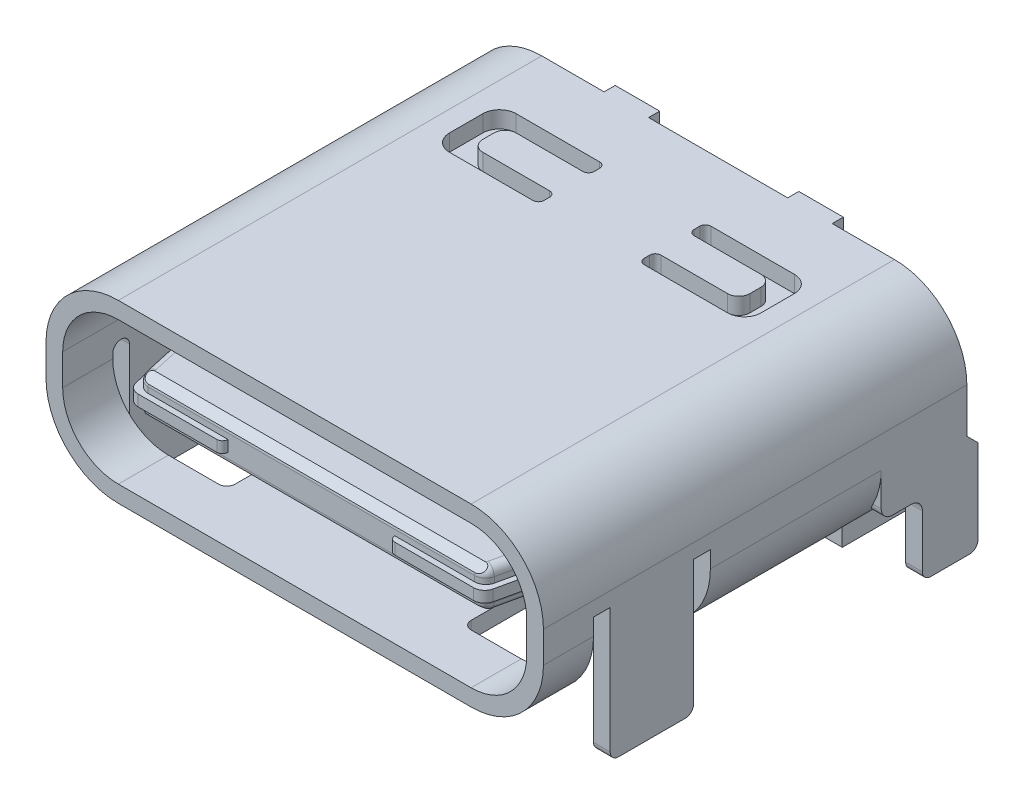
from build123d import *

# Parameters (mm, degrees)
BOSS_EXTRUDE1_DEPTH    = 7.61
SKETCH2_OUTSIDE_W      = 13.372
SKETCH2_OUTSIDE_H      = 7.592
CUT_EXTRUDE1_DEPTH     = 4.7
CUT_EXTRUDE2_DEPTH     = 0.3
BOSS_EXTRUDE2_DEPTH    = 0.2
BOSS_EXTRUDE3_DEPTH    = 0.3
CUT_EXTRUDE3_DEPTH     = 1.6
SKETCH7_W              = 8.34
SKETCH7_H              = 1.94
CUT_EXTRUDE4_DEPTH     = 0.15
BOSS_EXTRUDE4_DEPTH    = 1.94
BOSS_EXTRUDE5_DEPTH    = 0.2
BOSS_EXTRUDE5_2_DEPTH  = 0.2
BOSS_EXTRUDE5_3_DEPTH  = 0.2
BOSS_EXTRUDE5_4_DEPTH  = 0.2
BOSS_EXTRUDE5_5_DEPTH  = 0.2
BOSS_EXTRUDE5_6_DEPTH  = 0.2
BOSS_EXTRUDE5_7_DEPTH  = 0.2
BOSS_EXTRUDE5_8_DEPTH  = 0.2
BOSS_EXTRUDE5_9_DEPTH  = 0.2
BOSS_EXTRUDE5_10_DEPTH = 0.2
BOSS_EXTRUDE5_11_DEPTH = 0.2
BOSS_EXTRUDE5_12_DEPTH = 0.2
BOSS_EXTRUDE5_13_DEPTH = 0.2
BOSS_EXTRUDE5_14_DEPTH = 0.2
BOSS_EXTRUDE5_15_DEPTH = 0.2
BOSS_EXTRUDE5_16_DEPTH = 0.2
BOSS_EXTRUDE5_17_DEPTH = 0.2
BOSS_EXTRUDE5_18_DEPTH = 0.2
BOSS_EXTRUDE5_19_DEPTH = 0.2
BOSS_EXTRUDE5_20_DEPTH = 0.2
BOSS_EXTRUDE5_21_DEPTH = 0.2
BOSS_EXTRUDE5_22_DEPTH = 0.2
BOSS_EXTRUDE5_23_DEPTH = 0.2
BOSS_EXTRUDE5_24_DEPTH = 0.2
BOSS_EXTRUDE5_25_DEPTH = 0.2
BOSS_EXTRUDE5_26_DEPTH = 0.2
CUT_EXTRUDE5_START     = -6.55
CUT_EXTRUDE5_DEPTH     = 6.9
CUT_EXTRUDE6_START     = -6.2
CUT_EXTRUDE6_DEPTH     = 6.2
BOSS_EXTRUDE6_DEPTH    = 1.62
BOSS_EXTRUDE7_DEPTH    = 0.35
BOSS_EXTRUDE8_DEPTH    = 0.1
BOSS_EXTRUDE8_2_DEPTH  = 0.1
FILLET2_R              = 0.15
CUT_EXTRUDE10_DEPTH    = 12.979152799


with BuildPart() as part:
    # Sketch1 → Boss-Extrude1 (new body)
    with BuildSketch(Plane.XY):
        with BuildLine():
            Line((-4.47, 0.28), (-4.47, -0.28))
            ThreePointArc((-4.47, -0.28), (-4.089238816, -1.199238816), (-3.17, -1.58))
            Line((-3.17, -1.58), (3.17, -1.58))
            ThreePointArc((3.17, -1.58), (4.089238816, -1.199238816), (4.47, -0.28))
            Line((4.47, -0.28), (4.47, 0.28))
            ThreePointArc((4.47, 0.28), (4.089238816, 1.199238816), (3.17, 1.58))
            Line((3.17, 1.58), (-3.17, 1.58))
            ThreePointArc((-3.17, 1.58), (-4.089238816, 1.199238816), (-4.47, 0.28))
        make_face()
    extrude(amount=BOSS_EXTRUDE1_DEPTH)

    # Sketch2 outside → Cut-Extrude1 (cut)
    # profile 1 of 2: a face of its own
    with BuildSketch(Plane.XY.offset(7.61)):
        Rectangle(SKETCH2_OUTSIDE_W, SKETCH2_OUTSIDE_H)
        with BuildLine():
            Line((-4.47, 0.28), (-4.47, -0.28))
            ThreePointArc((-4.47, -0.28), (-4.089238816, -1.199238816), (-3.17, -1.58))
            Line((-3.17, -1.58), (3.17, -1.58))
            ThreePointArc((3.17, -1.58), (4.089238816, -1.199238816), (4.47, -0.28))
            Line((4.47, -0.28), (4.47, 0.28))
            ThreePointArc((4.47, 0.28), (4.089238816, 1.199238816), (3.17, 1.58))
            Line((3.17, 1.58), (-3.17, 1.58))
            ThreePointArc((-3.17, 1.58), (-4.089238816, 1.199238816), (-4.47, 0.28))
        make_face(mode=Mode.SUBTRACT)
    # profile 2 of 2: a face of its own
    with BuildSketch(Plane.XY.offset(7.61)):
        with BuildLine():
            Line((3.17, 1.28), (-3.17, 1.28))
            ThreePointArc((-3.17, 1.28), (-3.877106781, 0.987106781), (-4.17, 0.28))
            Line((-4.17, 0.28), (-4.17, -0.28))
            ThreePointArc((-4.17, -0.28), (-3.877106781, -0.987106781), (-3.17, -1.28))
            Line((-3.17, -1.28), (3.17, -1.28))
            ThreePointArc((3.17, -1.28), (3.877106781, -0.987106781), (4.17, -0.28))
            Line((4.17, -0.28), (4.17, 0.28))
            ThreePointArc((4.17, 0.28), (3.877106781, 0.987106781), (3.17, 1.28))
        make_face()
    extrude(amount=-CUT_EXTRUDE1_DEPTH, mode=Mode.SUBTRACT)

    # Sketch3 → Cut-Extrude2 (cut)
    with BuildSketch(Plane(origin=(0, 1.58, 0), x_dir=(1, 0, 0), z_dir=(0, 1, 0))):
        with BuildLine():
            Line((-0.9, -1.33), (-0.9, -1.23))
            ThreePointArc((-0.9, -1.23), (-0.929289322, -1.159289322), (-1, -1.13))
            Line((-1, -1.13), (-2.5, -1.13))
            ThreePointArc((-2.5, -1.13), (-2.712132034, -1.217867966), (-2.8, -1.43))
            Line((-2.8, -1.43), (-2.8, -2.03))
            ThreePointArc((-2.8, -2.03), (-2.712132034, -2.242132034), (-2.5, -2.33))
            Line((-2.5, -2.33), (-1, -2.33))
            ThreePointArc((-1, -2.33), (-0.929289322, -2.300710678), (-0.9, -2.23))
            Line((-0.9, -2.23), (-0.9, -2.13))
            ThreePointArc((-0.9, -2.13), (-0.929289322, -2.059289322), (-1, -2.03))
            Line((-1, -2.03), (-2.2, -2.03))
            ThreePointArc((-2.2, -2.03), (-2.341421356, -1.971421356), (-2.4, -1.83))
            Line((-2.4, -1.83), (-2.4, -1.63))
            ThreePointArc((-2.4, -1.63), (-2.341421356, -1.488578644), (-2.2, -1.43))
            Line((-2.2, -1.43), (-1, -1.43))
            ThreePointArc((-1, -1.43), (-0.929289322, -1.400710678), (-0.9, -1.33))
        make_face()
        with BuildLine():
            Line((2.5, -1.13), (1, -1.13))
            ThreePointArc((1, -1.13), (0.929289322, -1.159289322), (0.9, -1.23))
            Line((0.9, -1.23), (0.9, -1.33))
            ThreePointArc((0.9, -1.33), (0.929289322, -1.400710678), (1, -1.43))
            Line((1, -1.43), (2.2, -1.43))
            ThreePointArc((2.2, -1.43), (2.341421356, -1.488578644), (2.4, -1.63))
            Line((2.4, -1.63), (2.4, -1.83))
            ThreePointArc((2.4, -1.83), (2.341421356, -1.971421356), (2.2, -2.03))
            Line((2.2, -2.03), (1, -2.03))
            ThreePointArc((1, -2.03), (0.929289322, -2.059289322), (0.9, -2.13))
            Line((0.9, -2.13), (0.9, -2.23))
            ThreePointArc((0.9, -2.23), (0.929289322, -2.300710678), (1, -2.33))
            Line((1, -2.33), (2.5, -2.33))
            ThreePointArc((2.5, -2.33), (2.712132034, -2.242132034), (2.8, -2.03))
            Line((2.8, -2.03), (2.8, -1.43))
            ThreePointArc((2.8, -1.43), (2.712132034, -1.217867966), (2.5, -1.13))
        make_face()
    extrude(amount=-CUT_EXTRUDE2_DEPTH, mode=Mode.SUBTRACT)

    # Sketch4 → Boss-Extrude2 (add)
    with BuildSketch(Plane(origin=(0, 0, 0), x_dir=(-1, 0, 0), z_dir=(0, 0, -1))):
        with BuildLine():
            Line((-3.97, 0.48), (-3.97, -0.42))
            ThreePointArc((-3.97, -0.42), (-3.882132034, -0.632132034), (-3.67, -0.72))
            Line((-3.67, -0.72), (3.67, -0.72))
            ThreePointArc((3.67, -0.72), (3.882132034, -0.632132034), (3.97, -0.42))
            Line((3.97, -0.42), (3.97, 0.48))
            ThreePointArc((3.97, 0.48), (3.823553391, 0.833553391), (3.47, 0.98))
            Line((3.47, 0.98), (2.05, 0.98))
            Line((2.05, 0.98), (2.05, 1.58))
            Line((2.05, 1.58), (1.25, 1.58))
            Line((1.25, 1.58), (1.25, 0.98))
            Line((1.25, 0.98), (-1.25, 0.98))
            Line((-1.25, 0.98), (-1.25, 1.58))
            Line((-1.25, 1.58), (-2.05, 1.58))
            Line((-2.05, 1.58), (-2.05, 0.98))
            Line((-2.05, 0.98), (-3.47, 0.98))
            ThreePointArc((-3.47, 0.98), (-3.823553391, 0.833553391), (-3.97, 0.48))
        make_face()
    extrude(amount=BOSS_EXTRUDE2_DEPTH)

    # Sketch5 → Boss-Extrude3 (add)
    with BuildSketch(Plane(origin=(4.47, 0, 0), x_dir=(0, 0, -1), z_dir=(1, 0, 0))):
        with BuildLine():
            Line((-4.91, -0.28), (-6.41, -0.28))
            Line((-6.41, -0.28), (-6.41, -2.23))
            ThreePointArc((-6.41, -2.23), (-6.366066017, -2.336066017), (-6.26, -2.38))
            Line((-6.26, -2.38), (-5.06, -2.38))
            ThreePointArc((-5.06, -2.38), (-4.953933983, -2.336066017), (-4.91, -2.23))
            Line((-4.91, -2.23), (-4.91, -0.28))
        make_face()
        with BuildLine():
            ThreePointArc((-6.71, -0.2), (-6.56, -0.05), (-6.41, -0.2))
            Line((-6.41, -0.2), (-6.41, -0.28))
            Line((-6.41, -0.28), (-4.91, -0.28))
            Line((-4.91, -0.28), (-4.91, -0.2))
            ThreePointArc((-4.91, -0.2), (-4.76, -0.05), (-4.61, -0.2))
            Line((-4.61, -0.2), (-4.61, -0.28))
            Line((-4.61, -0.28), (-1.54, -0.28))
            Line((-1.54, -0.28), (0, -0.28))
            Line((0, -0.28), (0, 0.209679923))
            Line((0, 0.209679923), (-7.61, 0.209679923))
            Line((-7.61, 0.209679923), (-7.61, -0.28))
            Line((-7.61, -0.28), (-6.71, -0.28))
            Line((-6.71, -0.28), (-6.71, -0.2))
        make_face()
        with BuildLine():
            Line((0, -0.28), (-1.54, -0.28))
            Line((-1.54, -0.28), (-1.54, -0.88))
            ThreePointArc((-1.54, -0.88), (-1.481421356, -1.021421356), (-1.34, -1.08))
            Line((-1.34, -1.08), (-1, -1.08))
            ThreePointArc((-1, -1.08), (-0.858578644, -1.138578644), (-0.8, -1.28))
            Line((-0.8, -1.28), (-0.8, -2.23))
            ThreePointArc((-0.8, -2.23), (-0.756066017, -2.336066017), (-0.65, -2.38))
            Line((-0.65, -2.38), (0.05, -2.38))
            ThreePointArc((0.05, -2.38), (0.156066017, -2.336066017), (0.2, -2.23))
            Line((0.2, -2.23), (0.2, -0.72))
            Line((0.2, -0.72), (0, -0.52))
            Line((0, -0.52), (0, -0.28))
        make_face()
    boss_extrude3 = extrude(amount=-BOSS_EXTRUDE3_DEPTH)

    # Sketch6 → Cut-Extrude3 (cut)
    with BuildSketch(Plane.XZ.offset(1.58)):
        with BuildLine():
            Line((4.47, 4.61), (3.17, 4.61))
            Line((3.17, 4.61), (2.27, 4.61))
            ThreePointArc((2.27, 4.61), (2.163933983, 4.653933983), (2.12, 4.76))
            Line((2.12, 4.76), (2.12, 6.56))
            ThreePointArc((2.12, 6.56), (2.163933983, 6.666066017), (2.27, 6.71))
            Line((2.27, 6.71), (3.17, 6.71))
            Line((3.17, 6.71), (4.47, 6.71))
            Line((4.47, 6.71), (4.47, 6.41))
            Line((4.47, 6.41), (4.17, 6.41))
            Line((4.17, 6.41), (4.17, 4.91))
            Line((4.17, 4.91), (4.47, 4.91))
            Line((4.47, 4.91), (4.47, 4.61))
        make_face()
        with BuildLine():
            Line((-3.17, 4.61), (-4.47, 4.61))
            Line((-4.47, 4.61), (-4.47, 6.71))
            Line((-4.47, 6.71), (-3.17, 6.71))
            Line((-3.17, 6.71), (-2.27, 6.71))
            ThreePointArc((-2.27, 6.71), (-2.163933983, 6.666066017), (-2.12, 6.56))
            Line((-2.12, 6.56), (-2.12, 4.76))
            ThreePointArc((-2.12, 4.76), (-2.163933983, 4.653933983), (-2.27, 4.61))
            Line((-2.27, 4.61), (-3.17, 4.61))
        make_face()
    extrude(amount=-CUT_EXTRUDE3_DEPTH, mode=Mode.SUBTRACT)

    # Sketch7 → Cut-Extrude4 (cut)
    with BuildSketch(Plane.XZ.offset(1.58)):
        with Locations((0, 0.97)):
            Rectangle(SKETCH7_W, SKETCH7_H)
    extrude(amount=-CUT_EXTRUDE4_DEPTH, mode=Mode.SUBTRACT)

    # Sketch8 → Boss-Extrude4 (add)
    with BuildSketch(Plane(origin=(0, 0, 0), x_dir=(-1, 0, 0), z_dir=(0, 0, -1))):
        with BuildLine():
            Line((-3.776217783, -1.43), (-4.17, -1.43))
            Line((-4.17, -1.43), (-4.17, -1.110662386))
            ThreePointArc((-4.17, -1.110662386), (-3.988827222, -1.289713811), (-3.776217783, -1.43))
        make_face()
        with BuildLine():
            Line((4.17, -1.43), (4.17, -1.110662386))
            ThreePointArc((4.17, -1.110662386), (3.988827222, -1.289713811), (3.776217783, -1.43))
            Line((3.776217783, -1.43), (4.17, -1.43))
        make_face()
    extrude(amount=-BOSS_EXTRUDE4_DEPTH)

    # Mirror1: Boss-Extrude3 across plane
    add(boss_extrude3.mirror(Plane.ZY))


with BuildPart() as body_2:
    # Sketch9 → Boss-Extrude5 (new body)
    with BuildSketch(Plane.XZ.offset(1.43)):
        Polygon((-0.6, 0.05), (-0.6, -0.29), (-0.4, -0.29), (-0.4, 0.05), (-0.4, 0.2), (-0.6, 0.2), align=None)
    extrude(amount=BOSS_EXTRUDE5_DEPTH)


with BuildPart() as body_3:
    # Sketch9 → Boss-Extrude5 2 (new body)
    with BuildSketch(Plane.XZ.offset(1.43)):
        Polygon((-0.9, 0.05), (-0.9, 0.2), (-1.1, 0.2), (-1.1, 0.05), (-1.1, -0.29), (-0.9, -0.29), align=None)
    extrude(amount=BOSS_EXTRUDE5_2_DEPTH)


with BuildPart() as body_4:
    # Sketch9 → Boss-Extrude5 3 (new body)
    with BuildSketch(Plane.XZ.offset(1.43)):
        Polygon((-1.6, 0.05), (-1.6, -0.29), (-1.4, -0.29), (-1.4, 0.05), (-1.4, 0.2), (-1.6, 0.2), align=None)
    extrude(amount=BOSS_EXTRUDE5_3_DEPTH)


with BuildPart() as body_5:
    # Sketch9 → Boss-Extrude5 4 (new body)
    with BuildSketch(Plane.XZ.offset(1.43)):
        Polygon((-1.9, 0.05), (-1.9, 0.2), (-2.1, 0.2), (-2.1, 0.05), (-2.1, -0.29), (-1.9, -0.29), align=None)
    extrude(amount=BOSS_EXTRUDE5_4_DEPTH)


with BuildPart() as body_6:
    # Sketch9 → Boss-Extrude5 5 (new body)
    with BuildSketch(Plane.XZ.offset(1.43)):
        Polygon((-2.6, 0.05), (-2.6, -0.29), (-2.4, -0.29), (-2.4, 0.05), (-2.4, 0.2), (-2.6, 0.2), align=None)
    extrude(amount=BOSS_EXTRUDE5_5_DEPTH)


with BuildPart() as body_7:
    # Sketch9 → Boss-Extrude5 6 (new body)
    with BuildSketch(Plane.XZ.offset(1.43)):
        Polygon((-2.9, 0.05), (-2.9, 0.2), (-3.1, 0.2), (-3.1, 0.05), (-3.1, -0.29), (-2.9, -0.29), align=None)
    extrude(amount=BOSS_EXTRUDE5_6_DEPTH)


with BuildPart() as body_8:
    # Sketch9 → Boss-Extrude5 7 (new body)
    with BuildSketch(Plane.XZ.offset(1.43)):
        Polygon((0.6, 0.05), (0.6, 0.2), (0.4, 0.2), (0.4, 0.05), (0.4, -0.29), (0.6, -0.29), align=None)
    extrude(amount=BOSS_EXTRUDE5_7_DEPTH)


with BuildPart() as body_9:
    # Sketch9 → Boss-Extrude5 8 (new body)
    with BuildSketch(Plane.XZ.offset(1.43)):
        Polygon((0.9, 0.05), (0.9, -0.29), (1.1, -0.29), (1.1, 0.05), (1.1, 0.2), (0.9, 0.2), align=None)
    extrude(amount=BOSS_EXTRUDE5_8_DEPTH)


with BuildPart() as body_10:
    # Sketch9 → Boss-Extrude5 9 (new body)
    with BuildSketch(Plane.XZ.offset(1.43)):
        Polygon((1.6, 0.05), (1.6, 0.2), (1.4, 0.2), (1.4, 0.05), (1.4, -0.29), (1.6, -0.29), align=None)
    extrude(amount=BOSS_EXTRUDE5_9_DEPTH)


with BuildPart() as body_11:
    # Sketch9 → Boss-Extrude5 10 (new body)
    with BuildSketch(Plane.XZ.offset(1.43)):
        Polygon((1.9, 0.05), (1.9, -0.29), (2.1, -0.29), (2.1, 0.05), (2.1, 0.2), (1.9, 0.2), align=None)
    extrude(amount=BOSS_EXTRUDE5_10_DEPTH)


with BuildPart() as body_12:
    # Sketch9 → Boss-Extrude5 11 (new body)
    with BuildSketch(Plane.XZ.offset(1.43)):
        Polygon((2.6, 0.05), (2.6, 0.2), (2.4, 0.2), (2.4, 0.05), (2.4, -0.29), (2.6, -0.29), align=None)
    extrude(amount=BOSS_EXTRUDE5_11_DEPTH)


with BuildPart() as body_13:
    # Sketch9 → Boss-Extrude5 12 (new body)
    with BuildSketch(Plane.XZ.offset(1.43)):
        Polygon((2.9, 0.05), (2.9, -0.29), (3.1, -0.29), (3.1, 0.05), (3.1, 0.2), (2.9, 0.2), align=None)
    extrude(amount=BOSS_EXTRUDE5_12_DEPTH)


with BuildPart() as body_14:
    # Sketch9 → Boss-Extrude5 13 (new body)
    with BuildSketch(Plane.XZ.offset(1.43)):
        Polygon((2.65, 1.31), (2.65, 1.01), (2.85, 1.01), (2.85, 1.31), (2.85, 1.46), (2.65, 1.46), align=None)
    extrude(amount=BOSS_EXTRUDE5_13_DEPTH)


with BuildPart() as body_15:
    # Sketch9 → Boss-Extrude5 14 (new body)
    with BuildSketch(Plane.XZ.offset(1.43)):
        Polygon((3.45, 1.31), (3.45, 1.46), (3.15, 1.46), (3.15, 1.31), (3.15, 1.01), (3.45, 1.01), align=None)
    extrude(amount=BOSS_EXTRUDE5_14_DEPTH)


with BuildPart() as body_16:
    # Sketch9 → Boss-Extrude5 15 (new body)
    with BuildSketch(Plane.XZ.offset(1.43)):
        Polygon((2.15, 1.31), (2.15, 1.01), (2.35, 1.01), (2.35, 1.31), (2.35, 1.46), (2.15, 1.46), align=None)
    extrude(amount=BOSS_EXTRUDE5_15_DEPTH)


with BuildPart() as body_17:
    # Sketch9 → Boss-Extrude5 16 (new body)
    with BuildSketch(Plane.XZ.offset(1.43)):
        Polygon((1.85, 1.31), (1.85, 1.46), (1.65, 1.46), (1.65, 1.31), (1.65, 1.01), (1.85, 1.01), align=None)
    extrude(amount=BOSS_EXTRUDE5_16_DEPTH)


with BuildPart() as body_18:
    # Sketch9 → Boss-Extrude5 17 (new body)
    with BuildSketch(Plane.XZ.offset(1.43)):
        Polygon((1.15, 1.31), (1.15, 1.01), (1.35, 1.01), (1.35, 1.31), (1.35, 1.46), (1.15, 1.46), align=None)
    extrude(amount=BOSS_EXTRUDE5_17_DEPTH)


with BuildPart() as body_19:
    # Sketch9 → Boss-Extrude5 18 (new body)
    with BuildSketch(Plane.XZ.offset(1.43)):
        Polygon((0.85, 1.31), (0.85, 1.46), (0.65, 1.46), (0.65, 1.31), (0.65, 1.01), (0.85, 1.01), align=None)
    extrude(amount=BOSS_EXTRUDE5_18_DEPTH)


with BuildPart() as body_20:
    # Sketch9 → Boss-Extrude5 19 (new body)
    with BuildSketch(Plane.XZ.offset(1.43)):
        Polygon((0.15, 1.31), (0.15, 1.01), (0.35, 1.01), (0.35, 1.31), (0.35, 1.46), (0.15, 1.46), align=None)
    extrude(amount=BOSS_EXTRUDE5_19_DEPTH)


with BuildPart() as body_21:
    # Sketch9 → Boss-Extrude5 20 (new body)
    with BuildSketch(Plane.XZ.offset(1.43)):
        Polygon((-0.15, 1.31), (-0.15, 1.46), (-0.35, 1.46), (-0.35, 1.31), (-0.35, 1.01), (-0.15, 1.01), align=None)
    extrude(amount=BOSS_EXTRUDE5_20_DEPTH)


with BuildPart() as body_22:
    # Sketch9 → Boss-Extrude5 21 (new body)
    with BuildSketch(Plane.XZ.offset(1.43)):
        Polygon((-0.85, 1.31), (-0.85, 1.01), (-0.65, 1.01), (-0.65, 1.31), (-0.65, 1.46), (-0.85, 1.46), align=None)
    extrude(amount=BOSS_EXTRUDE5_21_DEPTH)


with BuildPart() as body_23:
    # Sketch9 → Boss-Extrude5 22 (new body)
    with BuildSketch(Plane.XZ.offset(1.43)):
        Polygon((-1.15, 1.31), (-1.15, 1.46), (-1.35, 1.46), (-1.35, 1.31), (-1.35, 1.01), (-1.15, 1.01), align=None)
    extrude(amount=BOSS_EXTRUDE5_22_DEPTH)


with BuildPart() as body_24:
    # Sketch9 → Boss-Extrude5 23 (new body)
    with BuildSketch(Plane.XZ.offset(1.43)):
        Polygon((-1.85, 1.31), (-1.85, 1.01), (-1.65, 1.01), (-1.65, 1.31), (-1.65, 1.46), (-1.85, 1.46), align=None)
    extrude(amount=BOSS_EXTRUDE5_23_DEPTH)


with BuildPart() as body_25:
    # Sketch9 → Boss-Extrude5 24 (new body)
    with BuildSketch(Plane.XZ.offset(1.43)):
        Polygon((-2.15, 1.31), (-2.15, 1.46), (-2.35, 1.46), (-2.35, 1.31), (-2.35, 1.01), (-2.15, 1.01), align=None)
    extrude(amount=BOSS_EXTRUDE5_24_DEPTH)


with BuildPart() as body_26:
    # Sketch9 → Boss-Extrude5 25 (new body)
    with BuildSketch(Plane.XZ.offset(1.43)):
        Polygon((-2.85, 1.31), (-2.85, 1.01), (-2.65, 1.01), (-2.65, 1.31), (-2.65, 1.46), (-2.85, 1.46), align=None)
    extrude(amount=BOSS_EXTRUDE5_25_DEPTH)


with BuildPart() as body_27:
    # Sketch9 → Boss-Extrude5 26 (new body)
    with BuildSketch(Plane.XZ.offset(1.43)):
        Polygon((-3.15, 1.31), (-3.15, 1.46), (-3.45, 1.46), (-3.45, 1.31), (-3.45, 1.01), (-3.15, 1.01), align=None)
    extrude(amount=BOSS_EXTRUDE5_26_DEPTH)


with BuildPart() as cut_extrude5_tool:
    # Sketch10 → Cut-Extrude5 (new body)
    with BuildSketch(Plane.ZY.offset(3.1).offset(CUT_EXTRUDE5_START)):
        with BuildLine():
            Line((1.01, -1.63), (1.31711545, -1.63))
            ThreePointArc((1.31711545, -1.63), (1.418150084, -1.588150084), (1.46, -1.48711545))
            Line((1.46, -1.48711545), (1.46, -1.43))
            Line((1.46, -1.43), (1.57898756, -1.531986034))
            Line((1.57898756, -1.531986034), (1.518730657, -1.78951256))
            Line((1.518730657, -1.78951256), (1.01, -1.63))
        make_face()
        with BuildLine():
            Line((-0.29, -1.63), (0.099975763, -1.63))
            ThreePointArc((0.099975763, -1.63), (0.170702109, -1.600719248), (0.2, -1.53))
            Line((0.2, -1.53), (0.2, -1.43))
            Line((0.2, -1.43), (0.448197351, -1.776454988))
            Line((0.448197351, -1.776454988), (0.039944898, -1.806792797))
            Line((0.039944898, -1.806792797), (-0.29, -1.63))
        make_face()
    extrude(amount=CUT_EXTRUDE5_DEPTH)


with BuildPart() as body_14_1:
    add(body_14.part)

    # Cut-Extrude5: cut by cut_extrude5_tool
    add(cut_extrude5_tool.part, mode=Mode.SUBTRACT)


with BuildPart() as body_15_1:
    add(body_15.part)

    # Cut-Extrude5: cut by cut_extrude5_tool
    add(cut_extrude5_tool.part, mode=Mode.SUBTRACT)


with BuildPart() as body_16_1:
    add(body_16.part)

    # Cut-Extrude5: cut by cut_extrude5_tool
    add(cut_extrude5_tool.part, mode=Mode.SUBTRACT)


with BuildPart() as body_17_1:
    add(body_17.part)

    # Cut-Extrude5: cut by cut_extrude5_tool
    add(cut_extrude5_tool.part, mode=Mode.SUBTRACT)


with BuildPart() as body_18_1:
    add(body_18.part)

    # Cut-Extrude5: cut by cut_extrude5_tool
    add(cut_extrude5_tool.part, mode=Mode.SUBTRACT)


with BuildPart() as body_19_1:
    add(body_19.part)

    # Cut-Extrude5: cut by cut_extrude5_tool
    add(cut_extrude5_tool.part, mode=Mode.SUBTRACT)


with BuildPart() as body_20_1:
    add(body_20.part)

    # Cut-Extrude5: cut by cut_extrude5_tool
    add(cut_extrude5_tool.part, mode=Mode.SUBTRACT)


with BuildPart() as body_21_1:
    add(body_21.part)

    # Cut-Extrude5: cut by cut_extrude5_tool
    add(cut_extrude5_tool.part, mode=Mode.SUBTRACT)


with BuildPart() as body_22_1:
    add(body_22.part)

    # Cut-Extrude5: cut by cut_extrude5_tool
    add(cut_extrude5_tool.part, mode=Mode.SUBTRACT)


with BuildPart() as body_23_1:
    add(body_23.part)

    # Cut-Extrude5: cut by cut_extrude5_tool
    add(cut_extrude5_tool.part, mode=Mode.SUBTRACT)


with BuildPart() as body_24_1:
    add(body_24.part)

    # Cut-Extrude5: cut by cut_extrude5_tool
    add(cut_extrude5_tool.part, mode=Mode.SUBTRACT)


with BuildPart() as body_25_1:
    add(body_25.part)

    # Cut-Extrude5: cut by cut_extrude5_tool
    add(cut_extrude5_tool.part, mode=Mode.SUBTRACT)


with BuildPart() as body_26_1:
    add(body_26.part)

    # Cut-Extrude5: cut by cut_extrude5_tool
    add(cut_extrude5_tool.part, mode=Mode.SUBTRACT)


with BuildPart() as body_27_1:
    add(body_27.part)

    # Cut-Extrude5: cut by cut_extrude5_tool
    add(cut_extrude5_tool.part, mode=Mode.SUBTRACT)


with BuildPart() as cut_extrude6_tool:
    # Sketch11 → Cut-Extrude6 (new body)
    with BuildSketch(Plane.ZY.offset(3.1).offset(CUT_EXTRUDE6_START)):
        with BuildLine():
            Line((-0.29, -1.63), (0.099975763, -1.63))
            ThreePointArc((0.099975763, -1.63), (0.170702109, -1.600719248), (0.2, -1.53))
            Line((0.2, -1.53), (0.2, -1.43))
            Line((0.2, -1.43), (0.448197351, -1.776454988))
            Line((0.448197351, -1.776454988), (0.039944898, -1.806792797))
            Line((0.039944898, -1.806792797), (-0.29, -1.63))
        make_face()
    extrude(amount=CUT_EXTRUDE6_DEPTH)


with BuildPart() as body_2_1:
    add(body_2.part)

    # Cut-Extrude6: cut by cut_extrude6_tool
    add(cut_extrude6_tool.part, mode=Mode.SUBTRACT)


with BuildPart() as body_3_1:
    add(body_3.part)

    # Cut-Extrude6: cut by cut_extrude6_tool
    add(cut_extrude6_tool.part, mode=Mode.SUBTRACT)


with BuildPart() as body_4_1:
    add(body_4.part)

    # Cut-Extrude6: cut by cut_extrude6_tool
    add(cut_extrude6_tool.part, mode=Mode.SUBTRACT)


with BuildPart() as body_5_1:
    add(body_5.part)

    # Cut-Extrude6: cut by cut_extrude6_tool
    add(cut_extrude6_tool.part, mode=Mode.SUBTRACT)


with BuildPart() as body_6_1:
    add(body_6.part)

    # Cut-Extrude6: cut by cut_extrude6_tool
    add(cut_extrude6_tool.part, mode=Mode.SUBTRACT)


with BuildPart() as body_7_1:
    add(body_7.part)

    # Cut-Extrude6: cut by cut_extrude6_tool
    add(cut_extrude6_tool.part, mode=Mode.SUBTRACT)


with BuildPart() as body_8_1:
    add(body_8.part)

    # Cut-Extrude6: cut by cut_extrude6_tool
    add(cut_extrude6_tool.part, mode=Mode.SUBTRACT)


with BuildPart() as body_9_1:
    add(body_9.part)

    # Cut-Extrude6: cut by cut_extrude6_tool
    add(cut_extrude6_tool.part, mode=Mode.SUBTRACT)


with BuildPart() as body_10_1:
    add(body_10.part)

    # Cut-Extrude6: cut by cut_extrude6_tool
    add(cut_extrude6_tool.part, mode=Mode.SUBTRACT)


with BuildPart() as body_11_1:
    add(body_11.part)

    # Cut-Extrude6: cut by cut_extrude6_tool
    add(cut_extrude6_tool.part, mode=Mode.SUBTRACT)


with BuildPart() as body_12_1:
    add(body_12.part)

    # Cut-Extrude6: cut by cut_extrude6_tool
    add(cut_extrude6_tool.part, mode=Mode.SUBTRACT)


with BuildPart() as body_13_1:
    add(body_13.part)

    # Cut-Extrude6: cut by cut_extrude6_tool
    add(cut_extrude6_tool.part, mode=Mode.SUBTRACT)


with BuildPart() as body_28:
    # Sketch12 → Boss-Extrude6 (new body)
    with BuildSketch(Plane.XY.offset(2.91)):
        with BuildLine():
            Line((-3.165, 0.2), (-3.165, -0.2))
            ThreePointArc((-3.165, -0.2), (-3.077132034, -0.412132034), (-2.865, -0.5))
            Line((-2.865, -0.5), (2.865, -0.5))
            ThreePointArc((2.865, -0.5), (3.077132034, -0.412132034), (3.165, -0.2))
            Line((3.165, -0.2), (3.165, 0.2))
            ThreePointArc((3.165, 0.2), (3.077132034, 0.412132034), (2.865, 0.5))
            Line((2.865, 0.5), (-2.865, 0.5))
            ThreePointArc((-2.865, 0.5), (-3.077132034, 0.412132034), (-3.165, 0.2))
        make_face()
    extrude(amount=BOSS_EXTRUDE6_DEPTH)

    # Sketch13 → Boss-Extrude7 (add, symmetric)
    with BuildSketch(Plane(origin=(0, 0, 0), x_dir=(1, 0, 0), z_dir=(0, 1, 0))):
        with BuildLine():
            Line((3.045, -6.06), (3.045, -4.53))
            Line((3.045, -4.53), (-3.045, -4.53))
            Line((-3.045, -4.53), (-3.045, -6.06))
            ThreePointArc((-3.045, -6.06), (-3.055557281, -6.104721359), (-3.085, -6.14))
            Line((-3.085, -6.14), (-3.205, -6.23))
            ThreePointArc((-3.205, -6.23), (-3.234442719, -6.26527864), (-3.245, -6.31))
            Line((-3.245, -6.31), (-3.245, -6.61))
            ThreePointArc((-3.245, -6.61), (-3.243816482, -6.631725709), (-3.240279936, -6.65319429))
            Line((-3.240279936, -6.65319429), (-3.129684113, -7.15319429))
            ThreePointArc((-3.129684113, -7.15319429), (-3.106674261, -7.211602255), (-3.066691743, -7.26))
            ThreePointArc((-3.066691743, -7.26), (-3.005114855, -7.297082869), (-2.934404177, -7.31))
            Line((-2.934404177, -7.31), (2.934404177, -7.31))
            ThreePointArc((2.934404177, -7.31), (3.005114855, -7.297082869), (3.066691743, -7.26))
            ThreePointArc((3.066691743, -7.26), (3.106674261, -7.211602255), (3.129684113, -7.15319429))
            Line((3.129684113, -7.15319429), (3.240279936, -6.65319429))
            ThreePointArc((3.240279936, -6.65319429), (3.243816482, -6.631725709), (3.245, -6.61))
            Line((3.245, -6.61), (3.245, -6.31))
            ThreePointArc((3.245, -6.31), (3.242324899, -6.287024708), (3.234442719, -6.265278641))
            ThreePointArc((3.234442719, -6.265278641), (3.221775173, -6.245925256), (3.205, -6.23))
            Line((3.205, -6.23), (3.085, -6.14))
            ThreePointArc((3.085, -6.14), (3.055557281, -6.10472136), (3.045, -6.06))
        make_face()
    extrude(amount=BOSS_EXTRUDE7_DEPTH, both=True)

    # Fillet2
    fillet2_edges = [body_28.edges().sort_by_distance(p)[0] for p in [
        (3.055557281, -0.35, 6.10472136),
        (3.045, -0.35, 5.295),
        (-3.045, -0.35, 5.295),
        (-3.055557281, -0.35, 6.104721359),
        (-3.145, -0.35, 6.185),
        (-3.234442719, -0.35, 6.26527864),
        (-3.245, -0.35, 6.46),
        (-3.243816482, -0.35, 6.631725709),
        (-3.184982024, -0.35, 6.90319429),
        (-3.059626264, -0.35, 7.265946879),
        (0, -0.35, 7.31),
        (3.059626264, -0.35, 7.265946879),
        (3.184982024, -0.35, 6.90319429),
        (3.243816482, -0.35, 6.631725709),
        (3.245, -0.35, 6.46),
        (3.234442719, -0.35, 6.265278641),
        (3.145, -0.35, 6.185),
        (3.055557281, 0.35, 6.10472136),
        (3.045, 0.35, 5.295),
        (-3.045, 0.35, 5.295),
        (-3.055557281, 0.35, 6.104721359),
        (-3.145, 0.35, 6.185),
        (-3.234442719, 0.35, 6.26527864),
        (-3.245, 0.35, 6.46),
        (-3.243816482, 0.35, 6.631725709),
        (-3.184982024, 0.35, 6.90319429),
        (-3.059626264, 0.35, 7.265946879),
        (0, 0.35, 7.31),
        (3.059626264, 0.35, 7.265946879),
        (3.184982024, 0.35, 6.90319429),
        (3.243816482, 0.35, 6.631725709),
        (3.245, 0.35, 6.46),
        (3.234442719, 0.35, 6.265278641),
        (3.145, 0.35, 6.185),
    ]]
    fillet(fillet2_edges, radius=FILLET2_R)

    # Sketch16 → Cut-Extrude10 (cut, through all)
    with BuildSketch(Plane(origin=(4.47, 0, 0), x_dir=(0, 0, -1), z_dir=(1, 0, 0))):
        Polygon((-7.363317357, -0.373330152), (-7.336052533, -0.218202706), (-7.117933943, -0.373330152), align=None)
        Polygon((-7.363317357, 0.373330152), (-7.336052533, 0.218202706), (-7.117933943, 0.373330152), align=None)
    extrude(amount=-CUT_EXTRUDE10_DEPTH, mode=Mode.SUBTRACT)


with BuildPart() as body_29:
    # Sketch14 → Boss-Extrude8 (new, symmetric)
    with BuildSketch(Plane(origin=(0, 0, 0), x_dir=(1, 0, 0), z_dir=(0, 1, 0))):
        with BuildLine():
            Line((-3.205, -6.23), (-3.085, -6.14))
            ThreePointArc((-3.085, -6.14), (-3.055557281, -6.104721359), (-3.045, -6.06))
            Line((-3.045, -6.06), (-3.045, -4.53))
            Line((-3.045, -4.53), (-3.091053964, -4.53))
            Line((-3.091053964, -4.53), (-3.091053964, -5.969540473))
            ThreePointArc((-3.091053964, -5.969540473), (-3.101611245, -6.014261832), (-3.131053964, -6.049540473))
            Line((-3.131053964, -6.049540473), (-3.305, -6.18))
            ThreePointArc((-3.305, -6.18), (-3.334442719, -6.21527864), (-3.345, -6.26))
            Line((-3.345, -6.26), (-3.345, -6.620927519))
            ThreePointArc((-3.345, -6.620927519), (-3.343816482, -6.642653228), (-3.340279936, -6.664121809))
            Line((-3.340279936, -6.664121809), (-3.209982024, -7.25319429))
            ThreePointArc((-3.209982024, -7.25319429), (-3.139924175, -7.365946879), (-3.014702089, -7.41))
            Line((-3.014702089, -7.41), (-1.6, -7.41))
            ThreePointArc((-1.6, -7.41), (-1.529289322, -7.380710678), (-1.5, -7.31))
            Line((-1.5, -7.31), (-2.934404177, -7.31))
            ThreePointArc((-2.934404177, -7.31), (-3.059626264, -7.265946879), (-3.129684113, -7.15319429))
            Line((-3.129684113, -7.15319429), (-3.240279936, -6.65319429))
            ThreePointArc((-3.240279936, -6.65319429), (-3.243816482, -6.631725709), (-3.245, -6.61))
            Line((-3.245, -6.61), (-3.245, -6.31))
            ThreePointArc((-3.245, -6.31), (-3.234442719, -6.26527864), (-3.205, -6.23))
        make_face()
    extrude(amount=BOSS_EXTRUDE8_DEPTH, both=True)


with BuildPart() as body_30:
    # Sketch14 → Boss-Extrude8 2 (new, symmetric)
    with BuildSketch(Plane(origin=(0, 0, 0), x_dir=(1, 0, 0), z_dir=(0, 1, 0))):
        with BuildLine():
            Line((3.305, -6.18), (3.131053964, -6.049540473))
            ThreePointArc((3.131053964, -6.049540473), (3.101611245, -6.014261832), (3.091053964, -5.969540473))
            Line((3.091053964, -5.969540473), (3.091053964, -4.53))
            Line((3.091053964, -4.53), (3.045, -4.53))
            Line((3.045, -4.53), (3.045, -6.06))
            ThreePointArc((3.045, -6.06), (3.055557281, -6.10472136), (3.085, -6.14))
            Line((3.085, -6.14), (3.205, -6.23))
            ThreePointArc((3.205, -6.23), (3.234442719, -6.265278641), (3.245, -6.31))
            Line((3.245, -6.31), (3.245, -6.61))
            ThreePointArc((3.245, -6.61), (3.243816482, -6.631725709), (3.240279936, -6.65319429))
            Line((3.240279936, -6.65319429), (3.129684113, -7.15319429))
            ThreePointArc((3.129684113, -7.15319429), (3.059626264, -7.265946879), (2.934404177, -7.31))
            Line((2.934404177, -7.31), (1.5, -7.31))
            ThreePointArc((1.5, -7.31), (1.529289322, -7.380710678), (1.6, -7.41))
            Line((1.6, -7.41), (3.014702089, -7.41))
            ThreePointArc((3.014702089, -7.41), (3.139924175, -7.365946879), (3.209982024, -7.25319429))
            Line((3.209982024, -7.25319429), (3.340279936, -6.664121809))
            ThreePointArc((3.340279936, -6.664121809), (3.343816482, -6.642653228), (3.345, -6.620927519))
            Line((3.345, -6.620927519), (3.345, -6.26))
            ThreePointArc((3.345, -6.26), (3.334442719, -6.21527864), (3.305, -6.18))
        make_face()
    extrude(amount=BOSS_EXTRUDE8_2_DEPTH, both=True)


solid = Compound([part.part, body_14_1.part, body_15_1.part, body_16_1.part, body_17_1.part, body_18_1.part, body_19_1.part, body_20_1.part, body_21_1.part, body_22_1.part, body_23_1.part, body_24_1.part, body_25_1.part, body_26_1.part, body_27_1.part, body_2_1.part, body_3_1.part, body_4_1.part, body_5_1.part, body_6_1.part, body_7_1.part, body_8_1.part, body_9_1.part, body_10_1.part, body_11_1.part, body_12_1.part, body_13_1.part, body_28.part, body_29.part, body_30.part])
